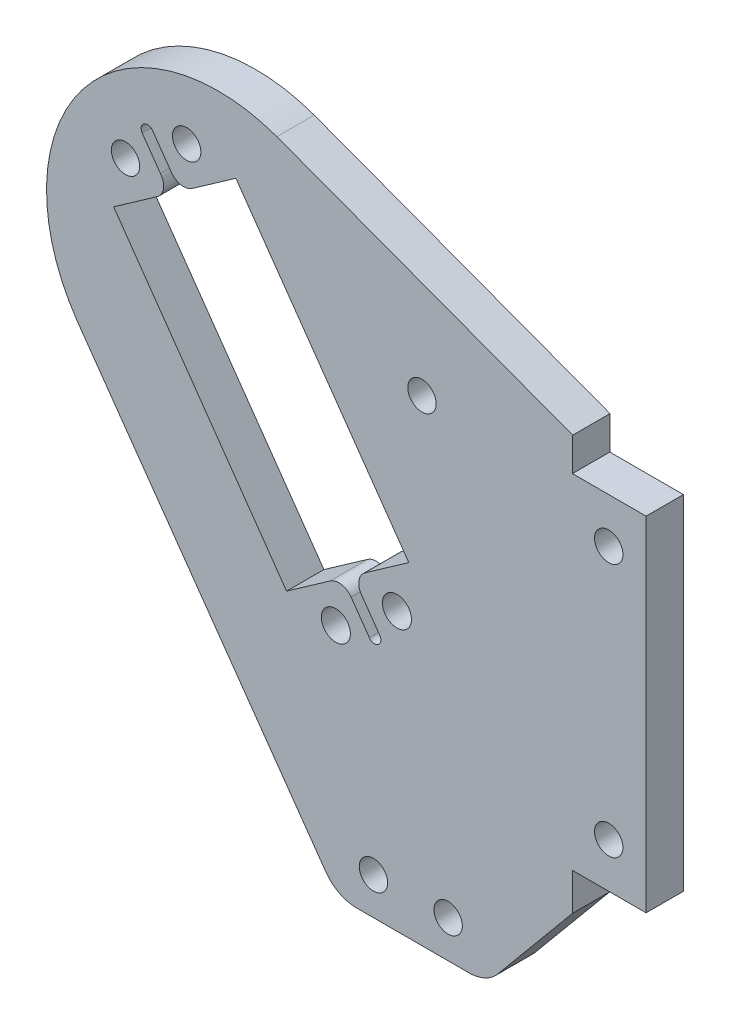
from build123d import *

# Parameters (mm, degrees)
ESQUISSE1_R        = 1.9
ESQUISSE1_R_2      = 1.950000027
BOSS_EXTRU_1_DEPTH = 5


with BuildPart() as part:
    # Esquisse1 → Boss.-Extru.1 (new body)
    with BuildSketch(Plane.XY):
        with BuildLine():
            Line((-36.042079519, 6.612329971), (-2.756888739, -40.60806749))
            ThreePointArc((-2.756888739, -40.60806749), (-0.971927818, -42.166026475), (1.329860158, -42.727358644))
            Line((1.329860158, -42.727358644), (16.414744778, -42.727358644))
            ThreePointArc((16.414744778, -42.727358644), (18.537962215, -42.254161899), (20.25929982, -40.92413773))
            Line((20.25929982, -40.92413773), (30.250474641, -28.908411747))
            Line((30.250474641, -28.908411747), (30.250474641, -23.914585762))
            Line((30.250474641, -23.914585762), (40.110474641, -23.914585762))
            Line((40.110474641, -23.914585762), (40.110474641, 22.085414238))
            Line((40.110474641, 22.085414238), (30.250474641, 22.085414238))
            Line((30.250474641, 22.085414238), (30.289127967, 26.563728114))
            Line((30.289127967, 26.563728114), (-9.322024272, 41.369413347))
            ThreePointArc((-9.322024272, 41.369413347), (-35.395503084, 33.764537489), (-36.042079519, 6.612329971))
        make_face()
        with Locations((-29.585096552, 28.740581162)):
            Circle(ESQUISSE1_R, mode=Mode.SUBTRACT)
        with Locations((-21.4008614, 34.486736198)):
            Circle(ESQUISSE1_R, mode=Mode.SUBTRACT)
        with Locations((-1.428936876, -11.362171084)):
            Circle(ESQUISSE1_R_2, mode=Mode.SUBTRACT)
        with Locations((6.755298276, -5.616016048)):
            Circle(ESQUISSE1_R_2, mode=Mode.SUBTRACT)
        with Locations((10.104149324, 21.053484932)):
            Circle(ESQUISSE1_R, mode=Mode.SUBTRACT)
        with Locations((3.608581782, -37.743606202)):
            Circle(ESQUISSE1_R, mode=Mode.SUBTRACT)
        with Locations((13.608573866, -37.73091599)):
            Circle(ESQUISSE1_R, mode=Mode.SUBTRACT)
        with Locations((35.110474641, -17.914585762)):
            Circle(ESQUISSE1_R, mode=Mode.SUBTRACT)
        with Locations((35.110474641, 16.085214419)):
            Circle(ESQUISSE1_R, mode=Mode.SUBTRACT)
        with BuildLine():
            Line((-14.809164556, 33.799672662), (-20.660891689, 29.691172522))
            ThreePointArc((-20.660891689, 29.691172522), (-22.18628804, 29.363713126), (-23.482781796, 30.231565432))
            Line((-23.482781796, 30.231565432), (-25.924897053, 33.709865414))
            ThreePointArc((-25.924897053, 33.709865414), (-26.47826462, 34.0839702), (-27.131559209, 33.944771651))
            ThreePointArc((-27.131559209, 33.944771651), (-27.478774003, 33.409530528), (-27.357701898, 32.783125931))
            Line((-27.357701898, 32.783125931), (-24.915585604, 29.304825893))
            ThreePointArc((-24.915585604, 29.304825893), (-24.495010021, 27.771470128), (-25.32590655, 26.415861527))
            Line((-25.32590655, 26.415861527), (-31.177633683, 22.307361387))
            Line((-31.177633683, 22.307361387), (-8.020629273, -10.675105791))
            Line((-8.020629273, -10.675105791), (-2.16890246, -6.566605875))
            ThreePointArc((-2.16890246, -6.566605875), (-0.674874752, -6.233398064), (0.617175813, -7.054221782))
            Line((0.617175813, -7.054221782), (3.05929141, -10.532521451))
            ThreePointArc((3.05929141, -10.532521451), (3.608413847, -10.881372123), (4.243376724, -10.739758611))
            ThreePointArc((4.243376724, -10.739758611), (4.592227421, -10.190636157), (4.450613892, -9.555673255))
            Line((4.450613892, -9.555673255), (2.008497767, -6.077373005))
            ThreePointArc((2.008497767, -6.077373005), (1.675290093, -4.583345549), (2.496113536, -3.291295137))
            Line((2.496113536, -3.291295137), (8.347839718, 0.817205678))
            Line((8.347839718, 0.817205678), (-14.809164556, 33.799672662))
        make_face(mode=Mode.SUBTRACT)
    extrude(amount=BOSS_EXTRU_1_DEPTH)


solid = part.part
